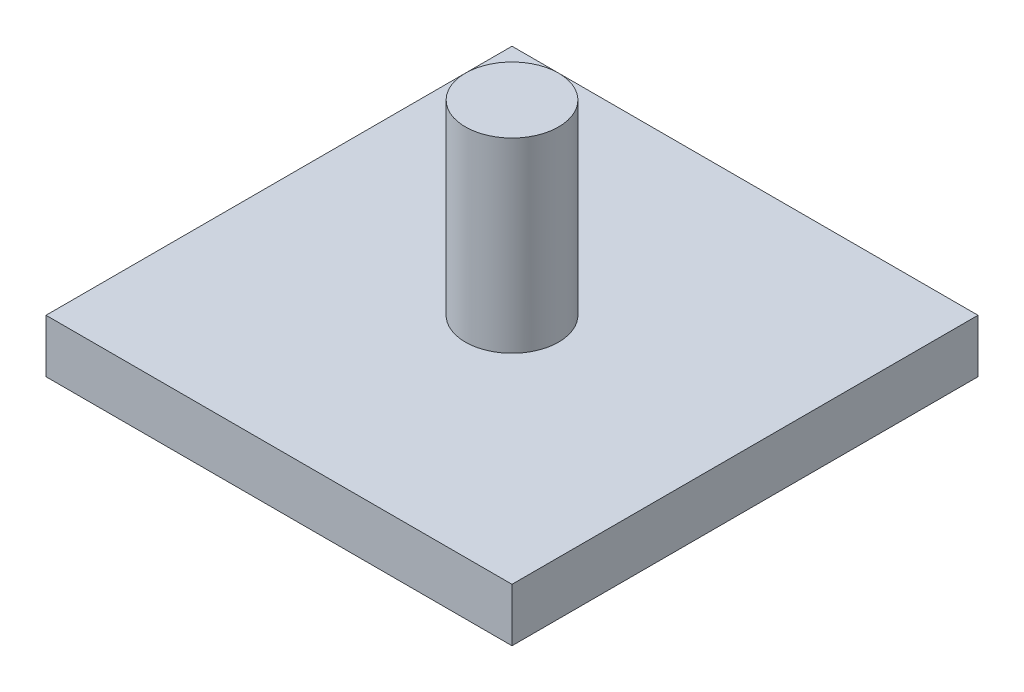
from build123d import *

# Parameters (mm, degrees)
SKETCH1_W           = 70
SKETCH1_H           = 70
BOSS_EXTRUDE1_DEPTH = 8
SKETCH3_W           = 7
SKETCH3_H           = 36


with BuildPart() as part:
    # Sketch1 → Boss-Extrude1 (new body)
    with BuildSketch(Plane(origin=(0, 0, 0), x_dir=(1, 0, 0), z_dir=(0, 1, 0))):
        Rectangle(SKETCH1_W, SKETCH1_H)
    extrude(amount=BOSS_EXTRUDE1_DEPTH)

    # Sketch3 → Revolve1 (revolve)
    with BuildSketch(Plane.XY, mode=Mode.PRIVATE) as revolve1_sk:
        with Locations((-3.5, 18)):
            Rectangle(SKETCH3_W, SKETCH3_H)
    revolve(revolve1_sk.sketch.rotate(Axis((0, -7.263286828, 0), (0, 1, 0)), 270), axis=Axis((0, -7.263286828, 0), (0, 1, 0)))


solid = part.part
